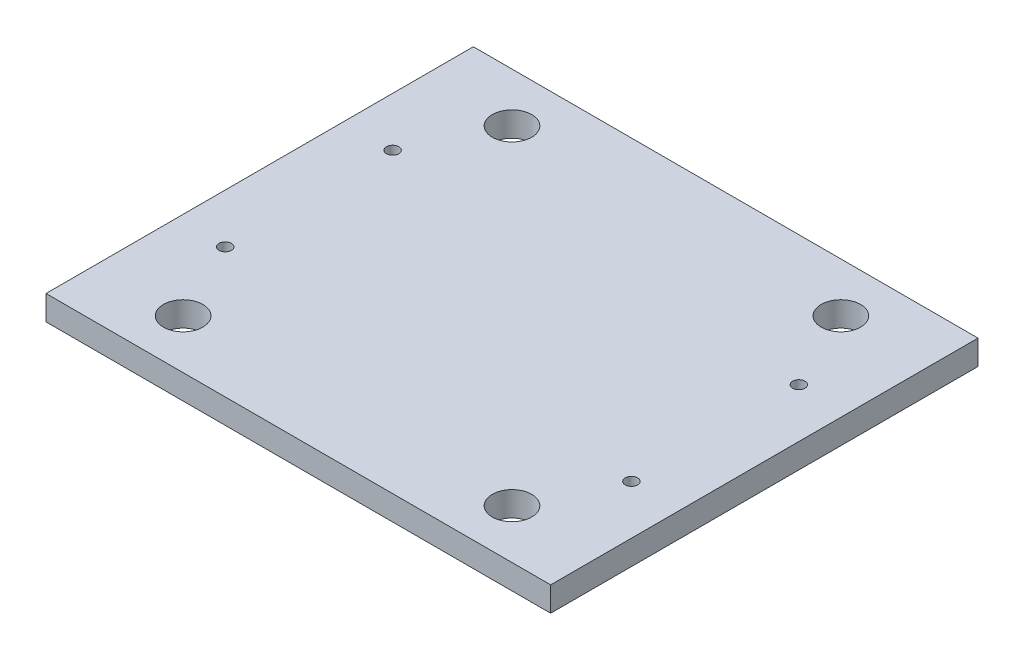
from build123d import *

# Parameters (mm, degrees)
SKETCH1_W           = 130.175
SKETCH1_H           = 110.236
SKETCH1_R           = 1.5875
SKETCH1_R_2         = 5.08
BOSS_EXTRUDE1_DEPTH = 6.35


with BuildPart() as part:
    # Sketch1 → Boss-Extrude1 (new body)
    with BuildSketch(Plane(origin=(0, 0, 0), x_dir=(1, 0, 0), z_dir=(0, 1, 0))):
        Rectangle(SKETCH1_W, SKETCH1_H)
        with Locations(Location((-52.3875, 21.59, 0), (0, 0, 270))):
            Circle(SKETCH1_R, mode=Mode.SUBTRACT)
        with Locations(Location((52.3875, 21.59, 0), (0, 0, 270))):
            Circle(SKETCH1_R, mode=Mode.SUBTRACT)
        with Locations(Location((52.3875, -21.59, 0), (0, 0, 270))):
            Circle(SKETCH1_R, mode=Mode.SUBTRACT)
        with Locations(Location((-52.3875, -21.59, 0), (0, 0, 270))):
            Circle(SKETCH1_R, mode=Mode.SUBTRACT)
        with Locations(Location((-42.418, 42.418, 0), (0, 0, 270))):
            Circle(SKETCH1_R_2, mode=Mode.SUBTRACT)
        with Locations(Location((42.418, 42.418, 0), (0, 0, 270))):
            Circle(SKETCH1_R_2, mode=Mode.SUBTRACT)
        with Locations(Location((42.418, -42.418, 0), (0, 0, 270))):
            Circle(SKETCH1_R_2, mode=Mode.SUBTRACT)
        with Locations(Location((-42.418, -42.418, 0), (0, 0, 270))):
            Circle(SKETCH1_R_2, mode=Mode.SUBTRACT)
    extrude(amount=BOSS_EXTRUDE1_DEPTH)


solid = part.part
